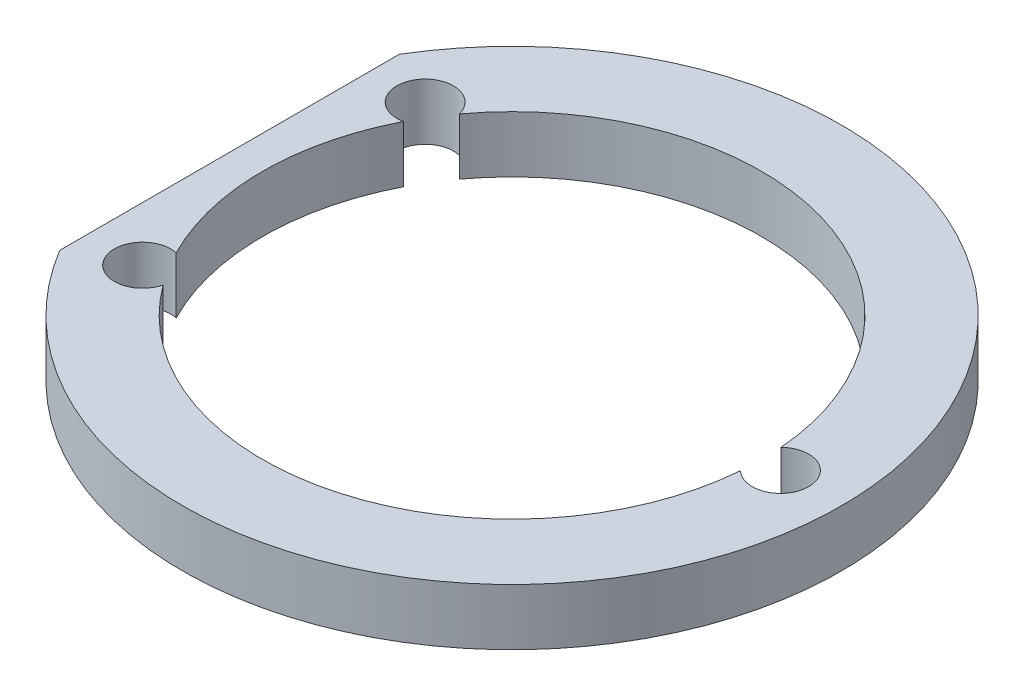
from build123d import *

# Parameters (mm, degrees)
EXTRUDE_1_DEPTH = 6


with BuildPart() as part:
    # 草图1 → 凸台-拉伸1 (new body)
    with BuildSketch(Plane(origin=(0, 0, 0), x_dir=(1, 0, 0), z_dir=(0, 1, 0))):
        with BuildLine():
            Line((-30, 18.027756377), (-30, -18.027756377))
            ThreePointArc((-30, -18.027756377), (35, 0), (-30, 18.027756377))
        make_face()
        with BuildLine():
            ThreePointArc((-21.324183136, 15.733061163), (-26.784109172, 16.578947368), (-23.591969867, 12.069339576))
            ThreePointArc((-23.591969867, 12.069339576), (-26.5, 0), (-23.591969867, -12.069339576))
            ThreePointArc((-23.591969867, -12.069339576), (-26.784109172, -16.578947368), (-21.324183136, -15.733061163))
            ThreePointArc((-21.324183136, -15.733061163), (7.250324934, -25.488875777), (26.412280702, -2.154397394))
            ThreePointArc((26.412280702, -2.154397394), (31.5, 0), (26.412280702, 2.154397394))
            ThreePointArc((26.412280702, 2.154397394), (7.250324934, 25.488875777), (-21.324183136, 15.733061163))
        make_face(mode=Mode.SUBTRACT)
    extrude(amount=EXTRUDE_1_DEPTH)


solid = part.part
